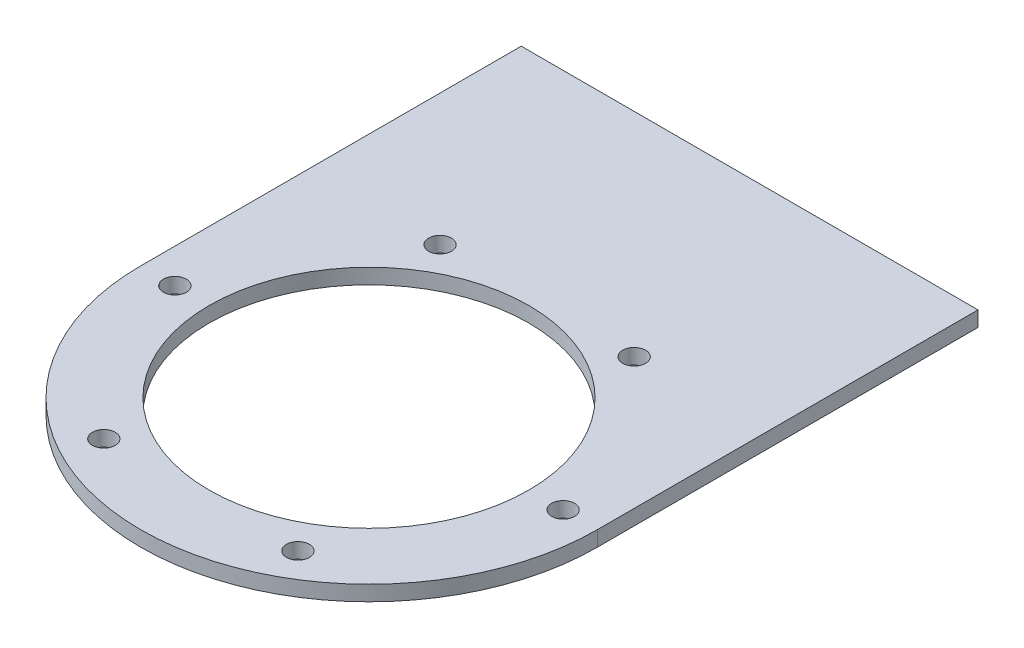
from build123d import *

# Parameters (mm, degrees)
SKETCH1_R           = 21
SKETCH1_R_2         = 1.5
BOSS_EXTRUDE1_DEPTH = 2


with BuildPart() as part:
    # Sketch1 → Boss-Extrude1 (new body)
    with BuildSketch(Plane(origin=(0, 0, 0), x_dir=(1, 0, 0), z_dir=(0, 1, 0))):
        with BuildLine():
            Line((-30, 0), (-30, 50))
            Line((-30, 50), (30, 50))
            Line((30, 50), (30, 0))
            ThreePointArc((30, 0), (0, -30), (-30, 0))
        make_face()
        with Locations(Location((0, 0, 0), (0, 0, 270))):
            Circle(SKETCH1_R, mode=Mode.SUBTRACT)
        with Locations(Location((-12.75, 22.083647797, 0), (0, 0, 270))):
            Circle(SKETCH1_R_2, mode=Mode.SUBTRACT)
        with Locations(Location((12.75, 22.083647797, 0), (0, 0, 270))):
            Circle(SKETCH1_R_2, mode=Mode.SUBTRACT)
        with Locations(Location((25.5, 0, 0), (0, 0, 270))):
            Circle(SKETCH1_R_2, mode=Mode.SUBTRACT)
        with Locations(Location((12.75, -22.083647797, 0), (0, 0, 270))):
            Circle(SKETCH1_R_2, mode=Mode.SUBTRACT)
        with Locations(Location((-12.75, -22.083647797, 0), (0, 0, 270))):
            Circle(SKETCH1_R_2, mode=Mode.SUBTRACT)
        with Locations(Location((-25.5, 0, 0), (0, 0, 270))):
            Circle(SKETCH1_R_2, mode=Mode.SUBTRACT)
    extrude(amount=BOSS_EXTRUDE1_DEPTH)


solid = part.part
